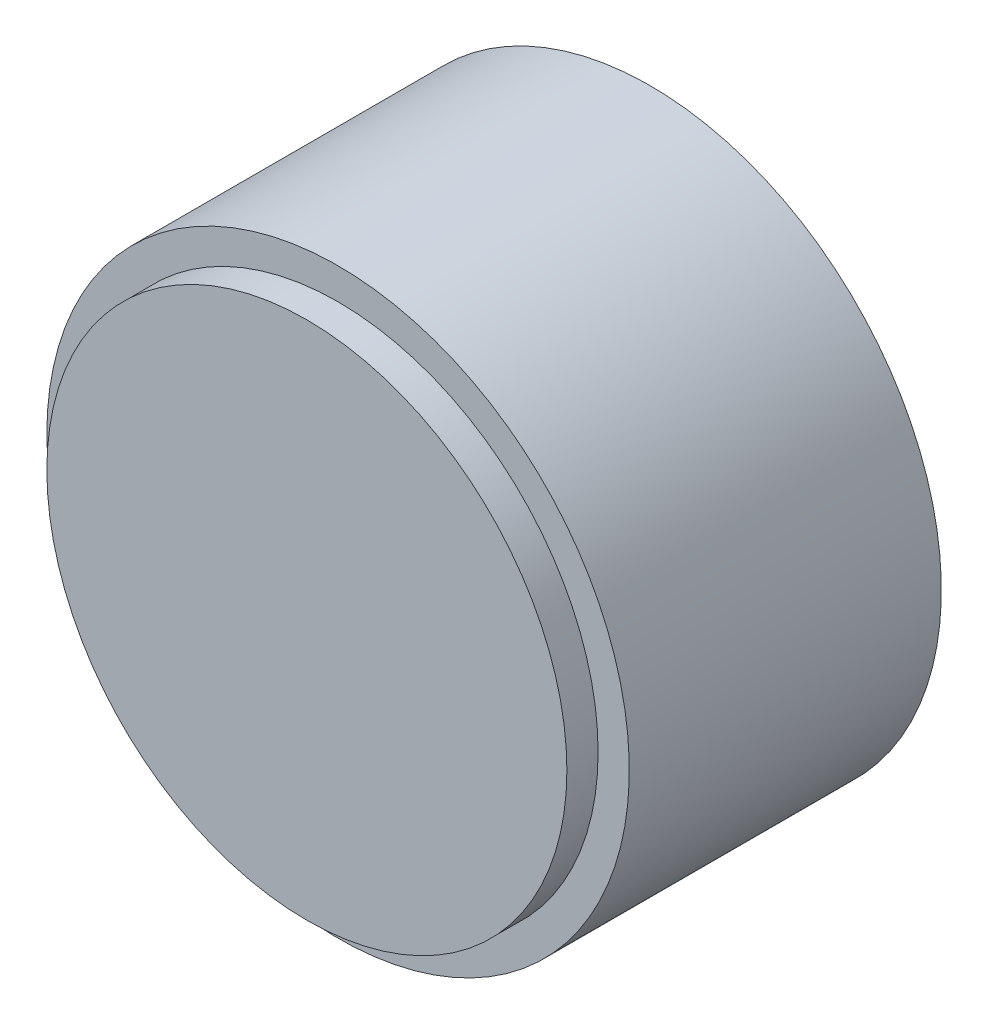
from build123d import *

# Parameters (mm, degrees)
ESQUISSE1_R             = 25
BOSS_EXTRU_1_DEPTH      = 35
BOSS_EXTRU_2_START      = -2
ESQUISSE3_R             = 28
ESQUISSE3_R_2           = 25
BOSS_EXTRU_2_DEPTH      = 30
ESQUISSE4_R             = 7
ESQUISSE4_R_2           = 2
BOSS_EXTRU_3_DEPTH      = 5
ESQUISSE5_R             = 1.5
ENL_V_MAT_EXTRU_1_DEPTH = 53.848841047


with BuildPart() as part:
    # Esquisse1 → Boss.-Extru.1 (new body)
    with BuildSketch(Plane.XY):
        Circle(ESQUISSE1_R)
    extrude(amount=BOSS_EXTRU_1_DEPTH)

    # Esquisse3 → Boss.-Extru.2 (add)
    with BuildSketch(Plane(origin=(0, 0, 0), x_dir=(-1, 0, 0), z_dir=(0, 0, -1)).offset(BOSS_EXTRU_2_START)):
        Circle(ESQUISSE3_R)
        Circle(ESQUISSE3_R_2, mode=Mode.SUBTRACT)
    extrude(amount=-BOSS_EXTRU_2_DEPTH)

    # Esquisse4 → Boss.-Extru.3 (add)
    with BuildSketch(Plane(origin=(0, 0, 0), x_dir=(-1, 0, 0), z_dir=(0, 0, -1))):
        Circle(ESQUISSE4_R)
        Circle(ESQUISSE4_R_2, mode=Mode.SUBTRACT)
    extrude(amount=BOSS_EXTRU_3_DEPTH)

    # Esquisse5 → Enlèv. mat.-Extru.1 (cut, through all)
    with BuildSketch(Plane(origin=(0, 0, 0), x_dir=(1, 0, 0), z_dir=(0, 1, 0))):
        with Locations(Location((0, 2.5, 0), (0, 0, 90))):
            Circle(ESQUISSE5_R)
    extrude(amount=ENL_V_MAT_EXTRU_1_DEPTH, mode=Mode.SUBTRACT)


solid = part.part
